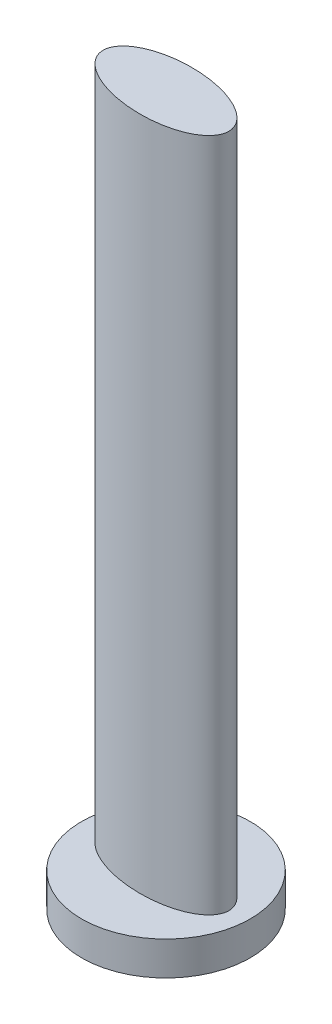
from build123d import *

# Parameters (mm, degrees)
SKETCH6_R           = 10
BOSS_EXTRUDE3_DEPTH = 4
SKETCH7_RX          = 7.9
SKETCH7_RY          = 3.9
BOSS_EXTRUDE4_DEPTH = 80


with BuildPart() as part:
    # Sketch6 → Boss-Extrude3 (new body)
    with BuildSketch(Plane(origin=(0, 0, 0), x_dir=(1, 0, 0), z_dir=(0, 1, 0))):
        with Locations(Location((0, 0, 0), (0, 0, 270))):
            Circle(SKETCH6_R)
    extrude(amount=BOSS_EXTRUDE3_DEPTH)

    # Sketch7 → Boss-Extrude4 (add)
    with BuildSketch(Plane(origin=(0, 4, 0), x_dir=(1, 0, 0), z_dir=(0, 1, 0))):
        with Locations(Location((0, 0), (0, 0, 175.826252623))):
            Ellipse(SKETCH7_RX, SKETCH7_RY)
    extrude(amount=BOSS_EXTRUDE4_DEPTH)


solid = part.part
